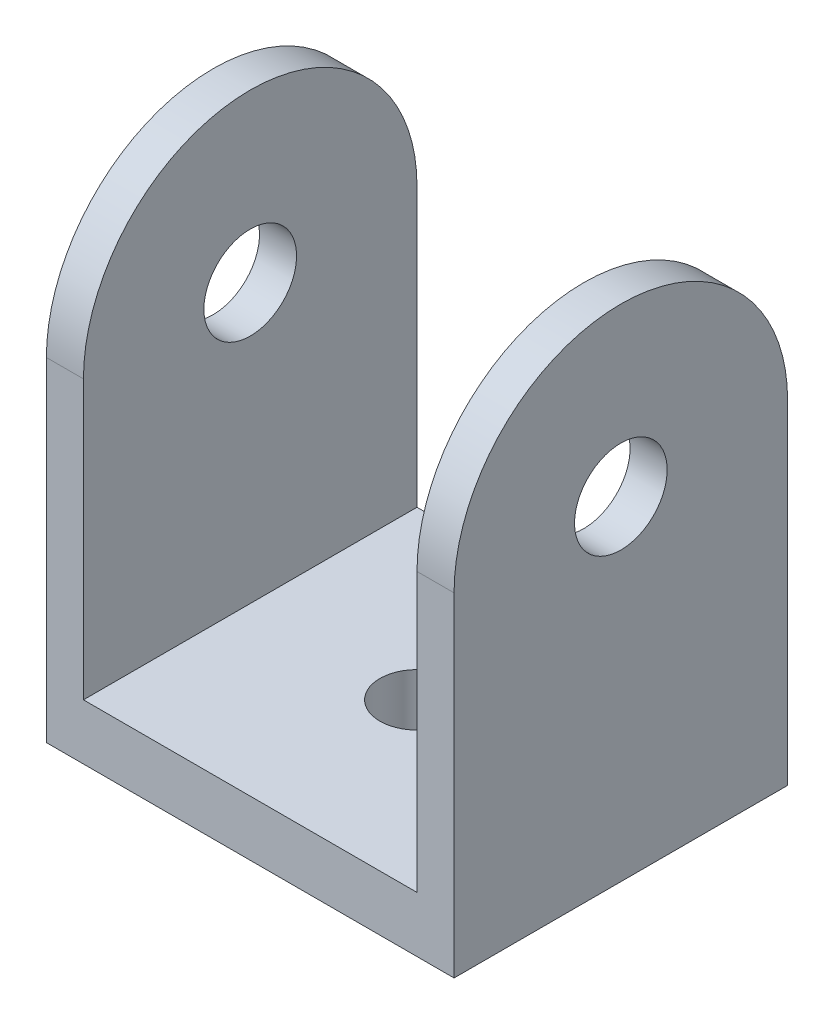
from build123d import *

# Parameters (mm, degrees)
SKETCH1_W           = 22
SKETCH1_H           = 18
SKETCH1_R           = 2
BOSS_EXTRUDE2_DEPTH = 3
SKETCH2_W           = 2
SKETCH2_H           = 18
BOSS_EXTRUDE3_DEPTH = 24
SKETCH3_R           = 2.5
CUT_EXTRUDE1_DEPTH  = 24


with BuildPart() as part:
    # Sketch1 → Boss-Extrude2 (new body)
    with BuildSketch(Plane(origin=(0, 0, 0), x_dir=(1, 0, 0), z_dir=(0, 1, 0))):
        Rectangle(SKETCH1_W, SKETCH1_H)
        with Locations(Location((0, 0, 0), (0, 0, 270))):
            Circle(SKETCH1_R, mode=Mode.SUBTRACT)
    boss_extrude2 = extrude(amount=BOSS_EXTRUDE2_DEPTH)

    # Sketch2 → Boss-Extrude3 (add)
    with BuildSketch(Plane(origin=(0, 3, 0), x_dir=(1, 0, 0), z_dir=(0, 1, 0))):
        with Locations((-10, 0)):
            Rectangle(SKETCH2_W, SKETCH2_H)
    boss_extrude3 = extrude(amount=BOSS_EXTRUDE3_DEPTH)

    # Sketch3 → Cut-Extrude1 (cut)
    with BuildSketch(Plane.ZY.offset(11)):
        with BuildLine():
            Line((9, 27), (0, 27))
            ThreePointArc((0, 27), (6.363961031, 24.363961031), (9, 18))
            Line((9, 18), (9, 27))
        make_face()
        with BuildLine():
            Line((-9, 27), (-9, 18))
            ThreePointArc((-9, 18), (-6.363961031, 24.363961031), (0, 27))
            Line((0, 27), (-9, 27))
        make_face()
        with Locations((0, 18)):
            Circle(SKETCH3_R)
    cut_extrude1 = extrude(amount=-CUT_EXTRUDE1_DEPTH, mode=Mode.SUBTRACT)

    # Mirror1: Boss-Extrude2, Boss-Extrude3, Cut-Extrude1 across plane
    add(boss_extrude2.mirror(Plane(origin=(0, 0, 0), x_dir=(0, 0, 1), z_dir=(1, 0, 0))))
    add(boss_extrude3.mirror(Plane(origin=(0, 0, 0), x_dir=(0, 0, 1), z_dir=(1, 0, 0))))
    add(cut_extrude1.mirror(Plane(origin=(0, 0, 0), x_dir=(0, 0, 1), z_dir=(1, 0, 0))), mode=Mode.SUBTRACT)


solid = part.part
